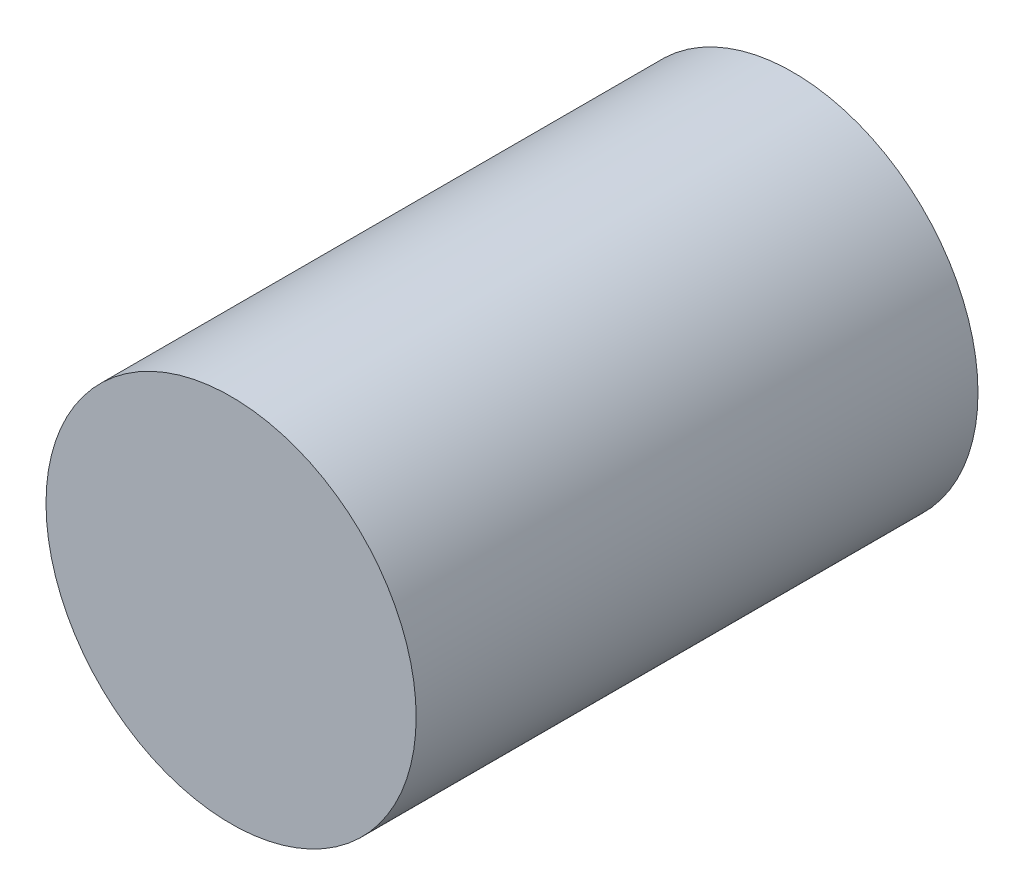
from build123d import *

# Parameters (mm, degrees)
SKETCH_1_R                        = 28
SOLID_OBS_03_OUTER_CYLINDER_DEPTH = 85


with BuildPart() as part:
    # 草图1 → solid_obs_03_outer_cylinder (new body)
    with BuildSketch(Plane.XY):
        Circle(SKETCH_1_R)
    extrude(amount=SOLID_OBS_03_OUTER_CYLINDER_DEPTH)


solid = part.part
